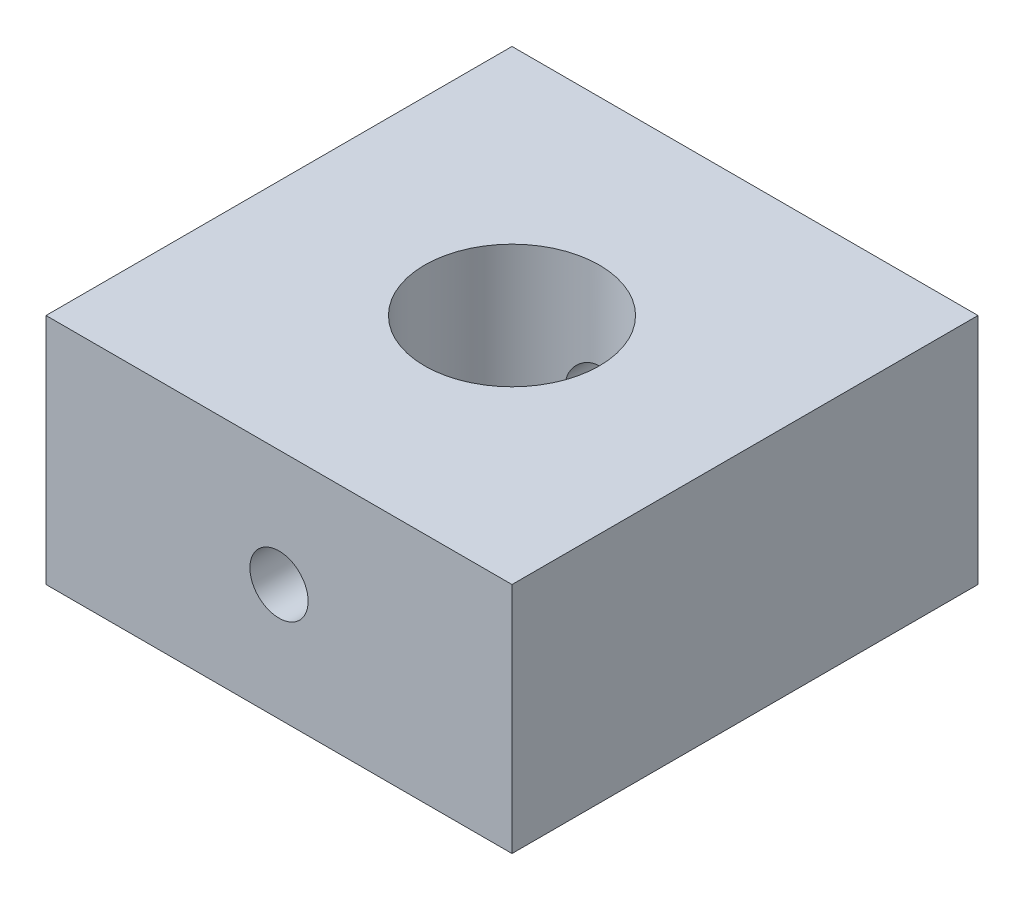
from build123d import *

# Parameters (mm, degrees)
SKETCH1_W           = 25.4
SKETCH1_H           = 25.4
SKETCH1_R           = 4.7625
BOSS_EXTRUDE1_DEPTH = 12.7
SKETCH2_R           = 1.5875
CUT_EXTRUDE1_DEPTH  = 39.1


with BuildPart() as part:
    # Sketch1 → Boss-Extrude1 (new body)
    with BuildSketch(Plane(origin=(0, 0, 0), x_dir=(1, 0, 0), z_dir=(0, 1, 0))):
        with Locations((12.7, 12.7)):
            Rectangle(SKETCH1_W, SKETCH1_H)
        with Locations(Location((12.7, 12.7, 0), (0, 0, 270))):
            Circle(SKETCH1_R, mode=Mode.SUBTRACT)
    extrude(amount=BOSS_EXTRUDE1_DEPTH)

    # Sketch2 → Cut-Extrude1 (cut, through all)
    with BuildSketch(Plane.XY):
        with Locations((12.7, 6.35)):
            Circle(SKETCH2_R)
    extrude(amount=-CUT_EXTRUDE1_DEPTH, mode=Mode.SUBTRACT)


solid = part.part
